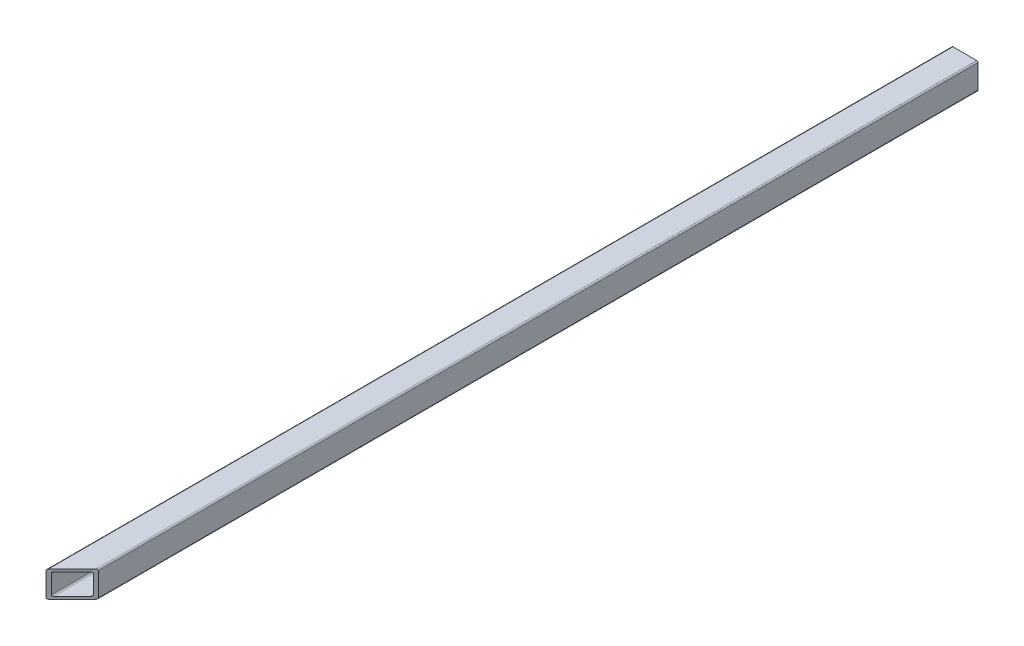
from build123d import *

# Parameters (mm, degrees)
BOSS_EXTRU_1_DEPTH      = 1380
ENL_V_MAT_EXTRU_1_DEPTH = 70


with BuildPart() as part:
    # Esquisse2 → Boss.-Extru.1 (new body)
    with BuildSketch(Plane.XY):
        with BuildLine():
            Line((2, 0), (38, 0))
            ThreePointArc((38, 0), (39.414213562, 0.585786438), (40, 2))
            Line((40, 2), (40, 38))
            ThreePointArc((40, 38), (39.414213562, 39.414213562), (38, 40))
            Line((38, 40), (2, 40))
            ThreePointArc((2, 40), (0.585786438, 39.414213562), (0, 38))
            Line((0, 38), (0, 2))
            ThreePointArc((0, 2), (0.585786438, 0.585786438), (2, 0))
        make_face()
        with BuildLine():
            Line((6, 4), (34, 4))
            ThreePointArc((34, 4), (35.414213562, 4.585786438), (36, 6))
            Line((36, 6), (36, 34))
            ThreePointArc((36, 34), (35.414213562, 35.414213562), (34, 36))
            Line((34, 36), (6, 36))
            ThreePointArc((6, 36), (4.585786438, 35.414213562), (4, 34))
            Line((4, 34), (4, 6))
            ThreePointArc((4, 6), (4.585786438, 4.585786438), (6, 4))
        make_face(mode=Mode.SUBTRACT)
    extrude(amount=BOSS_EXTRU_1_DEPTH)

    # Esquisse3 → Enlèv. mat.-Extru.1 (cut)
    with BuildSketch(Plane(origin=(0, 40, 0), x_dir=(1, 0, 0), z_dir=(0, 1, 0))):
        Polygon((0, -1380), (40, -1340), (40, -1380), align=None)
    extrude(amount=-ENL_V_MAT_EXTRU_1_DEPTH, mode=Mode.SUBTRACT)


solid = part.part
